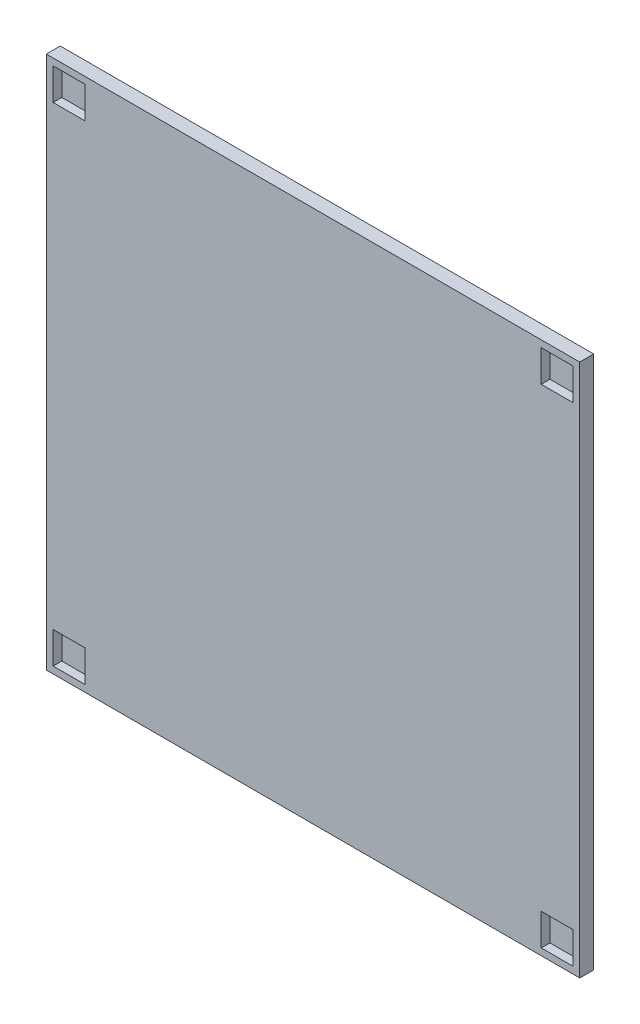
from build123d import *

# Parameters (mm, degrees)
SKETCH1_W           = 306
SKETCH1_H           = 306
BOSS_EXTRUDE1_DEPTH = 8
SKETCH2_W           = 18.2
SKETCH2_H           = 18.2
CUT_EXTRUDE1_DEPTH  = 5


with BuildPart() as part:
    # Sketch1 → Boss-Extrude1 (new body)
    with BuildSketch(Plane.XY):
        Rectangle(SKETCH1_W, SKETCH1_H)
    extrude(amount=BOSS_EXTRUDE1_DEPTH)

    # Sketch2 → Cut-Extrude1 (cut)
    with BuildSketch(Plane.XY.offset(8)):
        with Locations((140, 140)):
            Rectangle(SKETCH2_W, SKETCH2_H)
        with Locations((-140, 140)):
            Rectangle(SKETCH2_W, SKETCH2_H)
        with Locations((140, -140)):
            Rectangle(SKETCH2_W, SKETCH2_H)
        with Locations((-140, -140)):
            Rectangle(SKETCH2_W, SKETCH2_H)
    extrude(amount=-CUT_EXTRUDE1_DEPTH, mode=Mode.SUBTRACT)


solid = part.part
